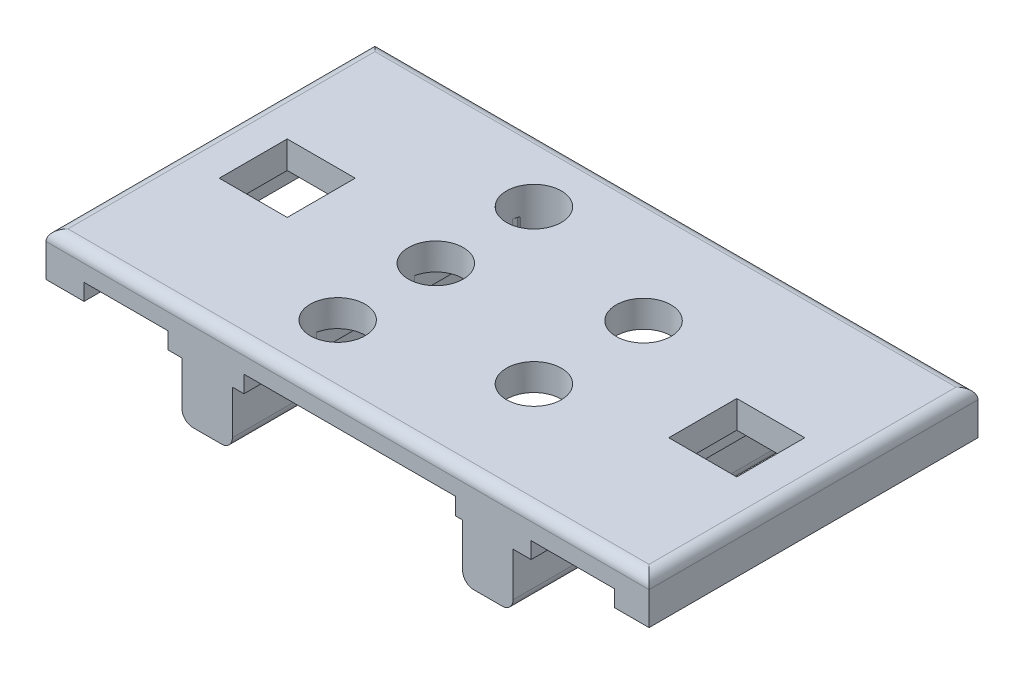
from build123d import *

# Parameters (mm, degrees)
SKETCH1_W           = 55
SKETCH1_H           = 4
SKETCH1_W_2         = 4.6
SKETCH1_H_2         = 5
BOSS_EXTRUDE2_DEPTH = 30
FILLET1_R           = 1
SKETCH2_R           = 2.5
SKETCH2_W           = 6.2
SKETCH2_H           = 6.2
CUT_EXTRUDE1_DEPTH  = 10
SKETCH4_W           = 19.295263263
SKETCH4_H           = 1.550295644
SKETCH4_W_2         = 7.637827672
SKETCH4_H_2         = 1.509017847
SKETCH4_W_3         = 7.600819518
SKETCH4_H_3         = 1.495167717
CUT_EXTRUDE2_DEPTH  = 25


with BuildPart() as part:
    # Sketch1 → Boss-Extrude2 (new body)
    with BuildSketch(Plane.XY):
        Rectangle(SKETCH1_W, SKETCH1_H)
        with Locations((-12.8, -4.5)):
            Rectangle(SKETCH1_W_2, SKETCH1_H_2)
        with Locations((12.8, -4.5)):
            Rectangle(SKETCH1_W_2, SKETCH1_H_2)
    extrude(amount=BOSS_EXTRUDE2_DEPTH)

    # Fillet1
    fillet1_edges = [part.edges().sort_by_distance(p)[0] for p in [
        (0, 2, 30),
        (0, 2, 0),
        (15.1, -7, 15),
        (10.5, -7, 15),
        (-10.5, -7, 15),
        (-15.1, -7, 15),
        (-27.5, 2, 15),
        (27.5, 2, 15),
    ]]
    fillet(fillet1_edges, radius=FILLET1_R)

    # Sketch2 → Cut-Extrude1 (cut)
    with BuildSketch(Plane(origin=(0, 2, 0), x_dir=(1, 0, 0), z_dir=(0, 1, 0))):
        with Locations(Location((-7, -6, 0), (0, 0, 270))):
            Circle(SKETCH2_R)
        with Locations(Location((-7, -14.949297523, 0), (0, 0, 270))):
            Circle(SKETCH2_R)
        with Locations(Location((-7, -23.898595046, 0), (0, 0, 270))):
            Circle(SKETCH2_R)
        with Locations(Location((7, -20, 0), (0, 0, 270))):
            Circle(SKETCH2_R)
        with Locations(Location((7, -10, 0), (0, 0, 270))):
            Circle(SKETCH2_R)
        with Locations((-20.5, -15)):
            Rectangle(SKETCH2_W, SKETCH2_H)
        with Locations((20.5, -15)):
            Rectangle(SKETCH2_W, SKETCH2_H)
    extrude(amount=-CUT_EXTRUDE1_DEPTH, mode=Mode.SUBTRACT)

    # Sketch4 → Cut-Extrude2 (cut)
    with BuildSketch(Plane.XY.offset(30)):
        with Locations((0.199720154, -1.224852178)):
            Rectangle(SKETCH4_W, SKETCH4_H)
        with Locations((-20.210751877, -1.245491077)):
            Rectangle(SKETCH4_W_2, SKETCH4_H_2)
        with Locations((20.547753604, -1.252416141)):
            Rectangle(SKETCH4_W_3, SKETCH4_H_3)
    extrude(amount=-CUT_EXTRUDE2_DEPTH, mode=Mode.SUBTRACT)


solid = part.part
